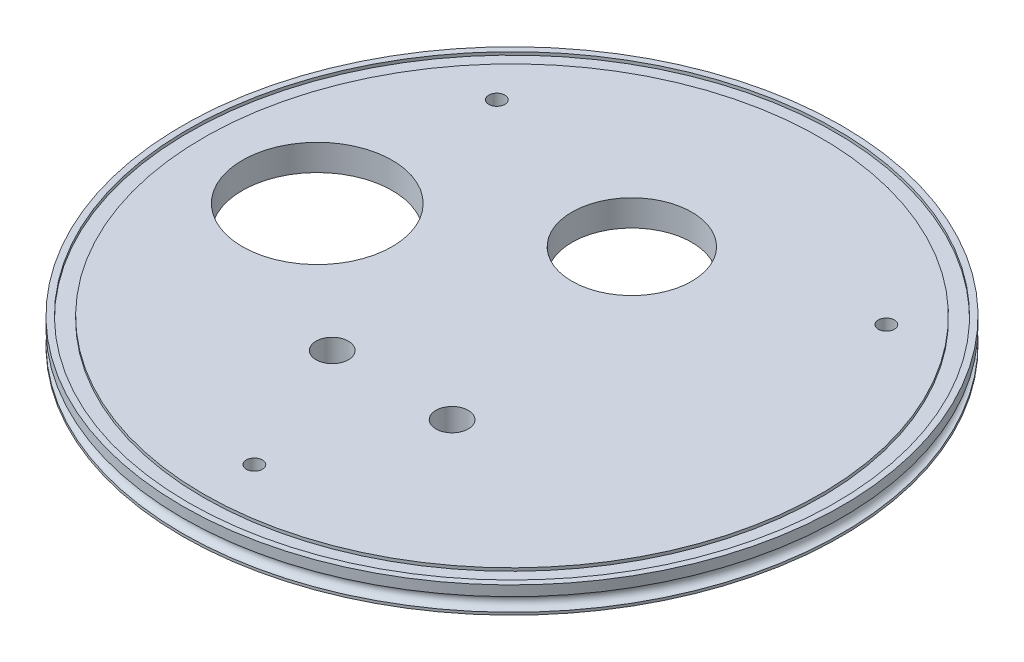
from build123d import *

# Parameters (mm, degrees)
SKETCH2_R          = 6.858
CUT_EXTRUDE1_DEPTH = 198.877910986
SKETCH3_R          = 25.4
SKETCH3_R_2        = 31.75
CUT_EXTRUDE3_DEPTH = 198.877910986
CUT_EXTRUDE4_START = -4.826
SKETCH4_R          = 3.429
CUT_EXTRUDE4_DEPTH = 6.35
SKETCH6_R          = 3.429
CUT_EXTRUDE6_DEPTH = 6.35


with BuildPart() as part:
    # Sketch1 → Revolve2 (revolve)
    with BuildSketch(Plane.XY, mode=Mode.PRIVATE) as revolve2_sk:
        with BuildLine():
            ThreePointArc((139.7, 6.7945), (136.8425, 3.937), (139.7, 1.0795))
            Line((139.7, 1.0795), (139.7, 0))
            Line((139.7, 0), (127, 0))
            Line((127, 0), (127, 2.54))
            Line((127, 2.54), (120.65, 2.54))
            Line((120.65, 2.54), (120.65, 0))
            Line((120.65, 0), (0, 0))
            Line((0, 0), (0, 11.1125))
            Line((0, 11.1125), (130.81, 11.1125))
            Line((130.81, 11.1125), (130.81, 9.8425))
            Line((130.81, 9.8425), (137.16, 9.8425))
            Line((137.16, 9.8425), (137.16, 11.1125))
            Line((137.16, 11.1125), (139.7, 11.1125))
            Line((139.7, 11.1125), (139.7, 6.7945))
        make_face()
    revolve(revolve2_sk.sketch.rotate(Axis((0, 28.20697446, 0), (0, -1, 0)), 90), axis=Axis((0, 28.20697446, 0), (0, -1, 0)))

    # Sketch2 → Cut-Extrude1 (cut, through all)
    with BuildSketch(Plane(origin=(0, 11.1125, 0), x_dir=(1, 0, 0), z_dir=(0, 1, 0))):
        with Locations(Location((-25.4, -50.8, 0), (0, 0, 270))):
            Circle(SKETCH2_R)
        with Locations(Location((25.4, -50.8, 0), (0, 0, 270))):
            Circle(SKETCH2_R)
    extrude(amount=-CUT_EXTRUDE1_DEPTH, mode=Mode.SUBTRACT)

    # Sketch3 → Cut-Extrude3 (cut, through all)
    with BuildSketch(Plane(origin=(0, 11.1125, 0), x_dir=(1, 0, 0), z_dir=(0, 1, 0))):
        with Locations(Location((0, 50.8, 0), (0, 0, 270))):
            Circle(SKETCH3_R)
        with Locations(Location((-82.55, 0, 0), (0, 0, 270))):
            Circle(SKETCH3_R_2)
    extrude(amount=-CUT_EXTRUDE3_DEPTH, mode=Mode.SUBTRACT)

    # Sketch4 → Cut-Extrude4 (cut)
    with BuildSketch(Plane(origin=(0, 11.1125, 0), x_dir=(1, 0, 0), z_dir=(0, 1, 0)).offset(CUT_EXTRUDE4_START)):
        with Locations(Location((57.15, 0, 0), (0, 0, 270))):
            Circle(SKETCH4_R)
        with Locations(Location((-48.26, -31.75, 0), (0, 0, 270))):
            Circle(SKETCH4_R)
        with Locations(Location((-48.26, 31.75, 0), (0, 0, 270))):
            Circle(SKETCH4_R)
    extrude(amount=-CUT_EXTRUDE4_DEPTH, mode=Mode.SUBTRACT)

    # Sketch6 → Cut-Extrude6 (cut)
    with BuildSketch(Plane(origin=(0, 11.1125, 0), x_dir=(1, 0, 0), z_dir=(0, 1, 0))):
        with Locations(Location((0, -109.22, 0), (0, 0, 270))):
            Circle(SKETCH6_R)
        with Locations(Location((82.55, 76.127347805, 0), (0, 0, 270))):
            Circle(SKETCH6_R)
        with Locations(Location((-82.55, 76.127347805, 0), (0, 0, 270))):
            Circle(SKETCH6_R)
    extrude(amount=-CUT_EXTRUDE6_DEPTH, mode=Mode.SUBTRACT)


solid = part.part
